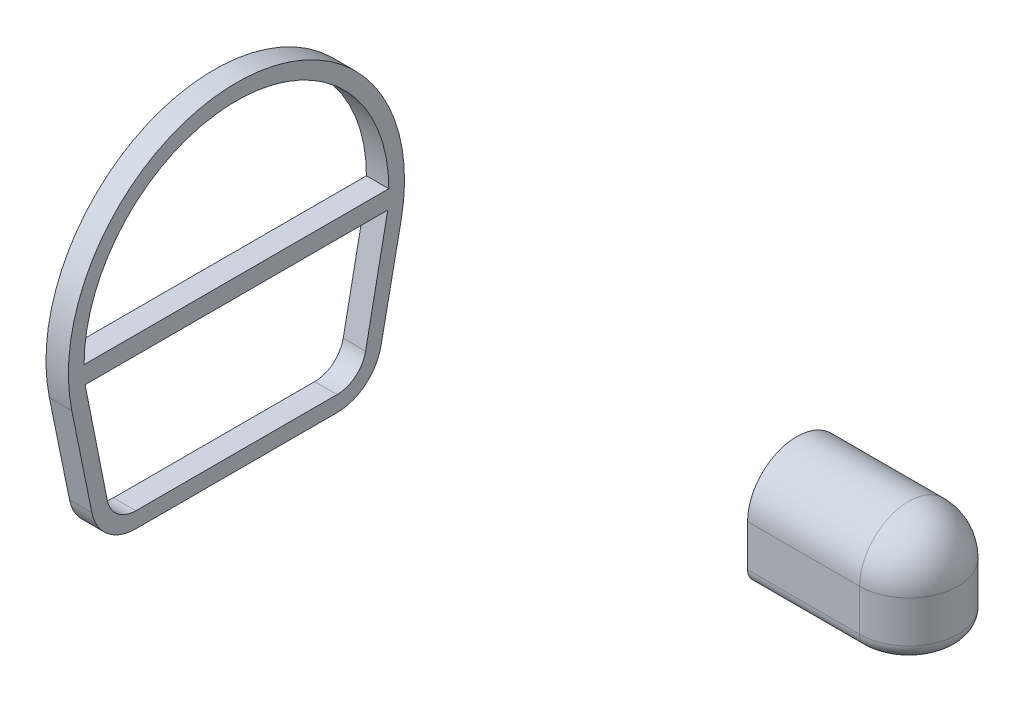
from build123d import *

# Parameters (mm, degrees)
BOSS_EXTRUDE1_DEPTH = 10
BOSS_EXTRUDE2_DEPTH = 50
REVOLVE1_ANGLE      = 180


with BuildPart() as part:
    # Sketch2 → Boss-Extrude1 (new body)
    with BuildSketch(Plane(origin=(0, 0, 0), x_dir=(0, 0, -1), z_dir=(1, 0, 0))):
        with BuildLine():
            Line((-73.484692283, -15), (-64.503229893, -59))
            ThreePointArc((-64.503229893, -59), (-57.556422592, -70.491933385), (-44.907311951, -75))
            Line((-44.907311951, -75), (44.907311951, -75))
            ThreePointArc((44.907311951, -75), (57.556422592, -70.491933385), (64.503229893, -59))
            Line((64.503229893, -59), (73.484692283, -15))
            ThreePointArc((73.484692283, -15), (0, 75), (-73.484692283, -15))
        make_face()
        with BuildLine():
            Line((-68, 0), (68, 0))
            ThreePointArc((68, 0), (0, 68), (-68, 0))
        make_face(mode=Mode.SUBTRACT)
        with BuildLine():
            Line((-67.527772065, -8), (67.527772065, -8))
            Line((67.527772065, -8), (57.644658613, -57.6))
            ThreePointArc((57.644658613, -57.6), (53.136949147, -65.091485327), (44.891808794, -68))
            Line((44.891808794, -68), (-44.907311951, -68))
            ThreePointArc((-44.907311951, -68), (-53.129233867, -65.0697567), (-57.644658614, -57.6))
            Line((-57.644658614, -57.6), (-67.527772065, -8))
        make_face(mode=Mode.SUBTRACT)
    extrude(amount=-BOSS_EXTRUDE1_DEPTH)


with BuildPart() as body_2:
    # Sketch11 → Boss-Extrude2 (new body)
    with BuildSketch(Plane(origin=(300, 0, 0), x_dir=(0, 0, -1), z_dir=(1, 0, 0))):
        with BuildLine():
            Line((-21.906217783, 41.28499573), (-21.906217783, 22.72249573))
            ThreePointArc((-21.906217783, 22.72249573), (-19.929188556, 17.949524957), (-15.156217783, 15.97249573))
            Line((-15.156217783, 15.97249573), (15.156217783, 15.97249573))
            ThreePointArc((15.156217783, 15.97249573), (19.929188556, 17.949524957), (21.906217783, 22.72249573))
            Line((21.906217783, 22.72249573), (21.906217783, 41.28499573))
            ThreePointArc((21.906217783, 41.28499573), (0, 63.191213514), (-21.906217783, 41.28499573))
        make_face()
        with BuildLine():
            Line((16.906217783, 22.72249573), (16.906217783, 41.28499573))
            ThreePointArc((16.906217783, 41.28499573), (0, 58.191213514), (-16.906217783, 41.28499573))
            Line((-16.906217783, 41.28499573), (-16.906217783, 22.72249573))
            ThreePointArc((-16.906217783, 22.72249573), (-16.393654651, 21.485058863), (-15.156217783, 20.97249573))
            Line((-15.156217783, 20.97249573), (15.156217783, 20.97249573))
            ThreePointArc((15.156217783, 20.97249573), (16.393654651, 21.485058863), (16.906217783, 22.72249573))
        make_face(mode=Mode.SUBTRACT)
    extrude(amount=-BOSS_EXTRUDE2_DEPTH)

    # Sketch12 → Revolve1 (revolve)
    with BuildSketch(Plane(origin=(300, 0, 0), x_dir=(0, 0, -1), z_dir=(1, 0, 0))):
        with BuildLine():
            Line((0, 20.97249573), (-15.156217783, 20.97249573))
            ThreePointArc((-15.156217783, 20.97249573), (-16.393654651, 21.485058863), (-16.906217783, 22.72249573))
            Line((-16.906217783, 22.72249573), (-16.906217783, 41.28499573))
            ThreePointArc((-16.906217783, 41.28499573), (-11.954501239, 53.239496969), (0, 58.191213514))
            Line((0, 58.191213514), (0, 63.191213514))
            ThreePointArc((0, 63.191213514), (-15.490035145, 56.775030875), (-21.906217783, 41.28499573))
            Line((-21.906217783, 41.28499573), (-21.906217783, 22.72249573))
            ThreePointArc((-21.906217783, 22.72249573), (-19.929188556, 17.949524957), (-15.156217783, 15.97249573))
            Line((-15.156217783, 15.97249573), (0, 15.97249573))
            Line((0, 15.97249573), (0, 20.97249573))
        make_face()
    revolve(axis=Axis((300, 58.191213514, 0), (0, 1, 0)), revolution_arc=REVOLVE1_ANGLE)


solid = Compound([part.part, body_2.part])
